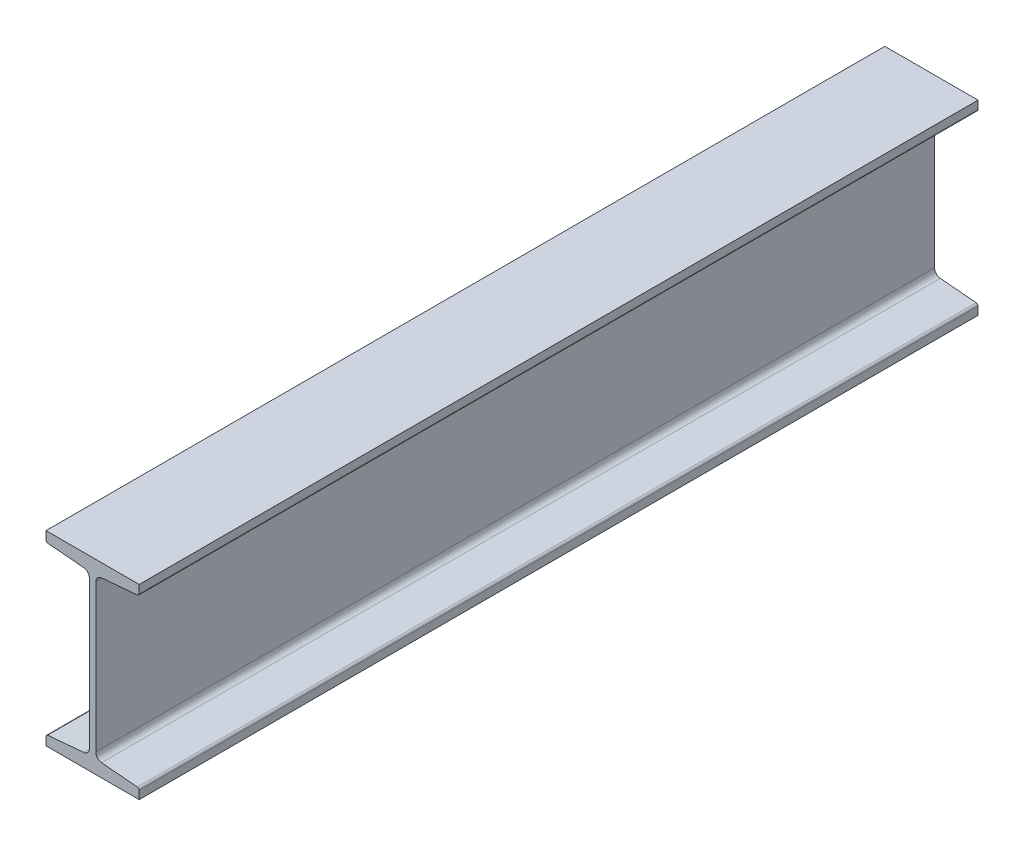
from build123d import *

# Parameters (mm, degrees)
BOSS_EXTRUDE1_START = -457.2
BOSS_EXTRUDE1_DEPTH = 914.4


with BuildPart() as part:
    # Sketch3 → Boss-Extrude1 (new body)
    with BuildSketch(Plane.XY.offset(BOSS_EXTRUDE1_START)):
        with BuildLine():
            Line((-50.8, -101.6), (50.8, -101.6))
            Line((50.8, -101.6), (50.8, -92.783359005))
            ThreePointArc((50.8, -92.783359005), (50.23278177, -91.324759746), (48.829169249, -90.632574652))
            Line((48.829169249, -90.632574652), (9.72517216, -87.211418208))
            ThreePointArc((9.72517216, -87.211418208), (5.25012518, -85.004569258), (3.4417, -80.354211623))
            Line((3.4417, -80.354211623), (3.4417, 80.354211623))
            ThreePointArc((3.4417, 80.354211623), (5.25012518, 85.004569258), (9.72517216, 87.211418208))
            Line((9.72517216, 87.211418208), (48.829169249, 90.632574652))
            ThreePointArc((48.829169249, 90.632574652), (50.23278177, 91.324759746), (50.8, 92.783359005))
            Line((50.8, 92.783359005), (50.8, 101.6))
            Line((50.8, 101.6), (-50.8, 101.6))
            Line((-50.8, 101.6), (-50.8, 92.783359005))
            ThreePointArc((-50.8, 92.783359005), (-50.23278177, 91.324759746), (-48.829169249, 90.632574652))
            Line((-48.829169249, 90.632574652), (-9.72517216, 87.211418208))
            ThreePointArc((-9.72517216, 87.211418208), (-5.25012518, 85.004569258), (-3.4417, 80.354211623))
            Line((-3.4417, 80.354211623), (-3.4417, -80.354211623))
            ThreePointArc((-3.4417, -80.354211623), (-5.25012518, -85.004569258), (-9.72517216, -87.211418208))
            Line((-9.72517216, -87.211418208), (-48.829169249, -90.632574652))
            ThreePointArc((-48.829169249, -90.632574652), (-50.23278177, -91.324759746), (-50.8, -92.783359005))
            Line((-50.8, -92.783359005), (-50.8, -101.6))
        make_face()
    extrude(amount=BOSS_EXTRUDE1_DEPTH)


solid = part.part
